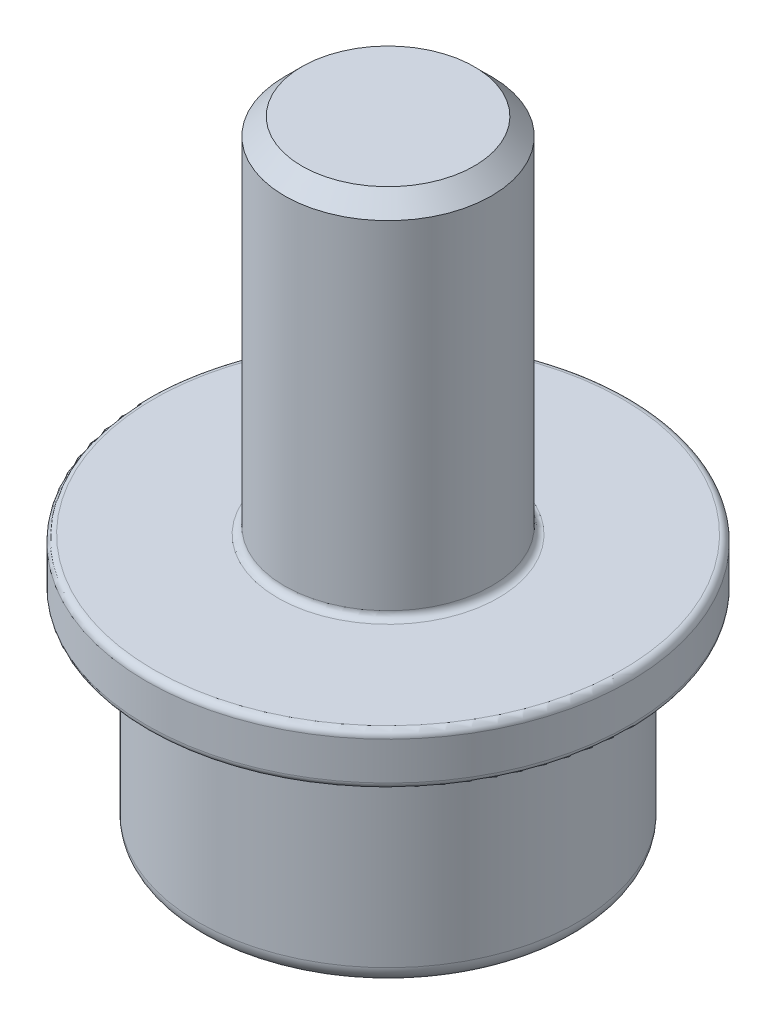
from build123d import *

# Parameters (mm, degrees)
SKETCH1_R           = 2.75
BOSS_EXTRUDE1_DEPTH = 3
SKETCH2_R           = 1.5
BOSS_EXTRUDE2_DEPTH = 6
CUT_EXTRUDE1_DEPTH  = 1.5
CHAMFER1_SIZE       = 0.25
FILLET1_R           = 0.25
CHAMFER2_SIZE       = 0.25
FILLET2_R           = 0.1
SKETCH4_R           = 3.5
SKETCH4_R_2         = 1.5
BOSS_EXTRUDE3_DEPTH = 0.75
FILLET3_R           = 0.1


with BuildPart() as part:
    # Sketch1 → Boss-Extrude1 (new body)
    with BuildSketch(Plane(origin=(0, 0, 0), x_dir=(1, 0, 0), z_dir=(0, 1, 0))):
        with Locations(Location((0, 0, 0), (0, 0, 270))):
            Circle(SKETCH1_R)
    extrude(amount=BOSS_EXTRUDE1_DEPTH)

    # Sketch2 → Boss-Extrude2 (add)
    with BuildSketch(Plane(origin=(0, 3, 0), x_dir=(1, 0, 0), z_dir=(0, 1, 0))):
        with Locations(Location((0, 0, 0), (0, 0, 270))):
            Circle(SKETCH2_R)
    extrude(amount=BOSS_EXTRUDE2_DEPTH)

    # Sketch3 → Cut-Extrude1 (cut)
    with BuildSketch(Plane.XZ):
        Polygon((0.934168857, 0.974591477), (-0.376936549, 1.2963097), (-1.311105406, 0.321718223), (-0.934168857, -0.974591477), (0.376936549, -1.2963097), (1.311105406, -0.321718223), align=None)
    extrude(amount=-CUT_EXTRUDE1_DEPTH, mode=Mode.SUBTRACT)

    # Chamfer1
    chamfer1_edges = [part.edges().sort_by_distance(p)[0] for p in [
        (1.122637131, 0, 0.326436627),
        (0.278616154, 0, 1.135450588),
        (-0.844020977, 0, 0.809013962),
        (-1.122637131, 0, -0.326436627),
        (-0.278616154, 0, -1.135450588),
        (0.844020977, 0, -0.809013962),
    ]]
    chamfer(chamfer1_edges, length=CHAMFER1_SIZE)

    # Fillet1
    fillet1_edges = [part.edges().sort_by_distance(p)[0] for p in [
        (0, 0, -2.75),
    ]]
    fillet(fillet1_edges, radius=FILLET1_R)

    # Chamfer2
    chamfer2_edges = [part.edges().sort_by_distance(p)[0] for p in [
        (0, 9, -1.5),
    ]]
    chamfer(chamfer2_edges, length=CHAMFER2_SIZE)

    # Fillet2
    fillet2_edges = [part.edges().sort_by_distance(p)[0] for p in [
        (0, 3, -2.75),
    ]]
    fillet(fillet2_edges, radius=FILLET2_R)

    # Sketch4 → Boss-Extrude3 (add)
    with BuildSketch(Plane(origin=(0, 3, 0), x_dir=(1, 0, 0), z_dir=(0, 1, 0))):
        with Locations(Location((0, 0, 0), (0, 0, 270))):
            Circle(SKETCH4_R)
        with Locations(Location((0, 0, 0), (0, 0, 270))):
            Circle(SKETCH4_R_2, mode=Mode.SUBTRACT)
    extrude(amount=BOSS_EXTRUDE3_DEPTH)

    # Fillet3
    fillet3_edges = [part.edges().sort_by_distance(p)[0] for p in [
        (0, 3.75, -3.5),
        (0, 3, -3.5),
        (0, 3.75, -1.5),
    ]]
    fillet(fillet3_edges, radius=FILLET3_R)


solid = part.part
